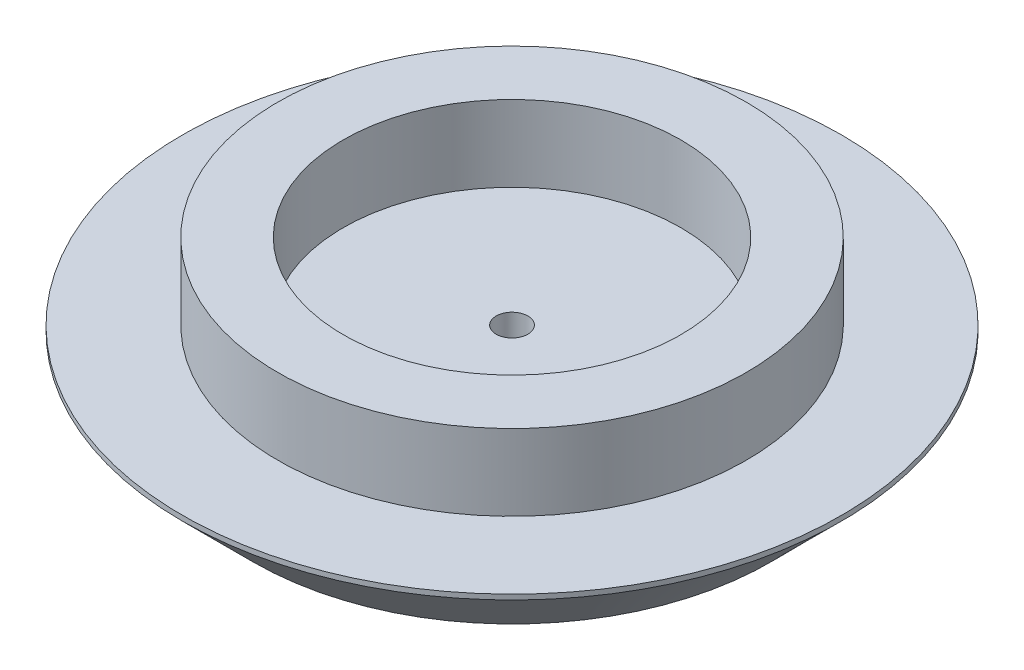
from build123d import *

# Parameters (mm, degrees)
CHAMFER1_SIZE                   = 8.89
F_5_32_0_15625_DIAMETER_HOLE1_D = 3.96875


with BuildPart() as part:
    # Sketch1 → Revolve1 (revolve)
    with BuildSketch(Plane.XY, mode=Mode.PRIVATE) as revolve1_sk:
        Polygon((-29.337, 0), (-41.275, 0), (-41.275, -9.525), (0, -9.525), (0, 0), (-21.1455, 0), (-21.1455, 9.525), (-29.337, 9.525), align=None)
    revolve(revolve1_sk.sketch.rotate(Axis((0, -9.525, 0), (0, 1, 0)), 270), axis=Axis((0, -9.525, 0), (0, 1, 0)))

    # Chamfer1
    chamfer1_edges = [part.edges().sort_by_distance(p)[0] for p in [
        (0, -9.525, 41.275),
    ]]
    chamfer(chamfer1_edges, length=CHAMFER1_SIZE)

    # 5/32 (0.15625) Diameter Hole1 (through all)
    with Locations(Plane(origin=(0, -9.525, 0), x_dir=(0, 0, -1), z_dir=(0, -1, 0))):
        with Locations((0, 0)):
            Hole(F_5_32_0_15625_DIAMETER_HOLE1_D / 2)


solid = part.part
